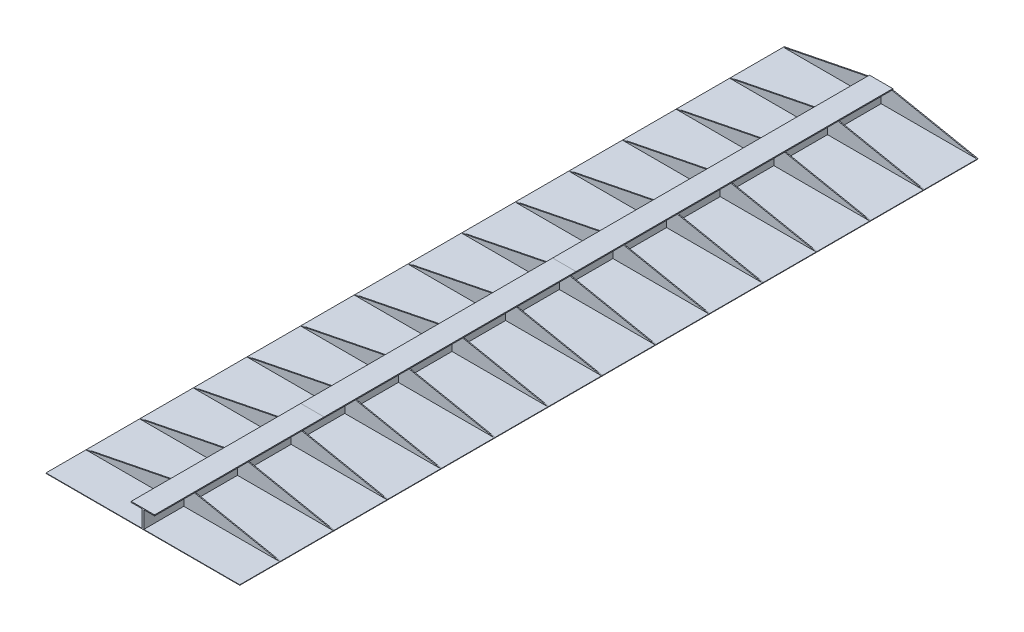
from build123d import *

# Parameters (mm, degrees)
BOSS_EXTRUDE1_DEPTH   = 7620
SKETCH7_W             = 110.65
SKETCH7_H             = 175.5
CUT_EXTRUDE3_DEPTH    = 7692.622044309
BOSS_EXTRUDE3_DEPTH   = 9.525
LPATTERN2_COUNT       = 14
LPATTERN2_PITCH       = 553.68
MIRROR2_COPY_1_DEPTH  = 9.525
MIRROR2_COPY_2_DEPTH  = 9.525
MIRROR2_COPY_3_DEPTH  = 9.525
MIRROR2_COPY_4_DEPTH  = 9.525
MIRROR2_COPY_5_DEPTH  = 9.525
MIRROR2_COPY_6_DEPTH  = 9.525
MIRROR2_COPY_7_DEPTH  = 9.525
MIRROR2_COPY_8_DEPTH  = 9.525
MIRROR2_COPY_9_DEPTH  = 9.525
MIRROR2_COPY_10_DEPTH = 9.525
MIRROR2_COPY_11_DEPTH = 9.525
MIRROR2_COPY_12_DEPTH = 9.525
MIRROR2_COPY_13_DEPTH = 9.525


with BuildPart() as part:
    # Sketch1 → Boss-Extrude1 (new body)
    with BuildSketch(Plane.XY):
        Polygon((-90, 185.5), (151.3, 185.5), (151.3, 0), (1030.65, 0), (1030.65, -5), (-969.35, -5), (-969.35, 0), (-90, 0), align=None)
    extrude(amount=-BOSS_EXTRUDE1_DEPTH)

    # Sketch7 → Cut-Extrude3 (cut, through all)
    with BuildSketch(Plane(origin=(0, 0, -7620), x_dir=(-1, 0, 0), z_dir=(0, 0, -1))):
        with Locations((-95.975, 87.75)):
            Rectangle(SKETCH7_W, SKETCH7_H)
        with Locations((34.675, 87.75)):
            Rectangle(SKETCH7_W, SKETCH7_H)
    extrude(amount=-CUT_EXTRUDE3_DEPTH, mode=Mode.SUBTRACT)

    # Sketch8 → Boss-Extrude3 (add)
    with BuildSketch(Plane(origin=(0, 0, -7620), x_dir=(-1, 0, 0), z_dir=(0, 0, -1))):
        Polygon((-40.65, 0), (-40.65, 175.5), (-151.3, 175.5), (-1030.65, 0), align=None)
    boss_extrude3 = extrude(amount=-BOSS_EXTRUDE3_DEPTH)

    # LPattern2: Boss-Extrude3 ×14
    with Locations(*[(0, 0, i * LPATTERN2_PITCH) for i in range(1, LPATTERN2_COUNT)]):
        add(boss_extrude3)

    # Mirror2: Boss-Extrude3 across plane
    add(boss_extrude3.mirror(Plane(origin=(30.65, 0, 0), x_dir=(0, 0, 1), z_dir=(1, 0, 0))))

    # Mirror2 copy 1 sketch → Mirror2 copy 1 (add)
    with BuildSketch(Plane(origin=(61.3, 0, -7066.32), x_dir=(1, 0, 0), z_dir=(0, 0, -1))):
        Polygon((-40.65, 0), (-40.65, -175.5), (-151.3, -175.5), (-1030.65, 0), align=None)
    extrude(amount=-MIRROR2_COPY_1_DEPTH)

    # Mirror2 copy 2 sketch → Mirror2 copy 2 (add)
    with BuildSketch(Plane(origin=(61.3, 0, -6512.64), x_dir=(1, 0, 0), z_dir=(0, 0, -1))):
        Polygon((-40.65, 0), (-40.65, -175.5), (-151.3, -175.5), (-1030.65, 0), align=None)
    extrude(amount=-MIRROR2_COPY_2_DEPTH)

    # Mirror2 copy 3 sketch → Mirror2 copy 3 (add)
    with BuildSketch(Plane(origin=(61.3, 0, -5958.96), x_dir=(1, 0, 0), z_dir=(0, 0, -1))):
        Polygon((-40.65, 0), (-40.65, -175.5), (-151.3, -175.5), (-1030.65, 0), align=None)
    extrude(amount=-MIRROR2_COPY_3_DEPTH)

    # Mirror2 copy 4 sketch → Mirror2 copy 4 (add)
    with BuildSketch(Plane(origin=(61.3, 0, -5405.28), x_dir=(1, 0, 0), z_dir=(0, 0, -1))):
        Polygon((-40.65, 0), (-40.65, -175.5), (-151.3, -175.5), (-1030.65, 0), align=None)
    extrude(amount=-MIRROR2_COPY_4_DEPTH)

    # Mirror2 copy 5 sketch → Mirror2 copy 5 (add)
    with BuildSketch(Plane(origin=(61.3, 0, -4851.6), x_dir=(1, 0, 0), z_dir=(0, 0, -1))):
        Polygon((-40.65, 0), (-40.65, -175.5), (-151.3, -175.5), (-1030.65, 0), align=None)
    extrude(amount=-MIRROR2_COPY_5_DEPTH)

    # Mirror2 copy 6 sketch → Mirror2 copy 6 (add)
    with BuildSketch(Plane(origin=(61.3, 0, -4297.92), x_dir=(1, 0, 0), z_dir=(0, 0, -1))):
        Polygon((-40.65, 0), (-40.65, -175.5), (-151.3, -175.5), (-1030.65, 0), align=None)
    extrude(amount=-MIRROR2_COPY_6_DEPTH)

    # Mirror2 copy 7 sketch → Mirror2 copy 7 (add)
    with BuildSketch(Plane(origin=(61.3, 0, -3744.24), x_dir=(1, 0, 0), z_dir=(0, 0, -1))):
        Polygon((-40.65, 0), (-40.65, -175.5), (-151.3, -175.5), (-1030.65, 0), align=None)
    extrude(amount=-MIRROR2_COPY_7_DEPTH)

    # Mirror2 copy 8 sketch → Mirror2 copy 8 (add)
    with BuildSketch(Plane(origin=(61.3, 0, -3190.56), x_dir=(1, 0, 0), z_dir=(0, 0, -1))):
        Polygon((-40.65, 0), (-40.65, -175.5), (-151.3, -175.5), (-1030.65, 0), align=None)
    extrude(amount=-MIRROR2_COPY_8_DEPTH)

    # Mirror2 copy 9 sketch → Mirror2 copy 9 (add)
    with BuildSketch(Plane(origin=(61.3, 0, -2636.88), x_dir=(1, 0, 0), z_dir=(0, 0, -1))):
        Polygon((-40.65, 0), (-40.65, -175.5), (-151.3, -175.5), (-1030.65, 0), align=None)
    extrude(amount=-MIRROR2_COPY_9_DEPTH)

    # Mirror2 copy 10 sketch → Mirror2 copy 10 (add)
    with BuildSketch(Plane(origin=(61.3, 0, -2083.2), x_dir=(1, 0, 0), z_dir=(0, 0, -1))):
        Polygon((-40.65, 0), (-40.65, -175.5), (-151.3, -175.5), (-1030.65, 0), align=None)
    extrude(amount=-MIRROR2_COPY_10_DEPTH)

    # Mirror2 copy 11 sketch → Mirror2 copy 11 (add)
    with BuildSketch(Plane(origin=(61.3, 0, -1529.52), x_dir=(1, 0, 0), z_dir=(0, 0, -1))):
        Polygon((-40.65, 0), (-40.65, -175.5), (-151.3, -175.5), (-1030.65, 0), align=None)
    extrude(amount=-MIRROR2_COPY_11_DEPTH)

    # Mirror2 copy 12 sketch → Mirror2 copy 12 (add)
    with BuildSketch(Plane(origin=(61.3, 0, -975.84), x_dir=(1, 0, 0), z_dir=(0, 0, -1))):
        Polygon((-40.65, 0), (-40.65, -175.5), (-151.3, -175.5), (-1030.65, 0), align=None)
    extrude(amount=-MIRROR2_COPY_12_DEPTH)

    # Mirror2 copy 13 sketch → Mirror2 copy 13 (add)
    with BuildSketch(Plane(origin=(61.3, 0, -422.16), x_dir=(1, 0, 0), z_dir=(0, 0, -1))):
        Polygon((-40.65, 0), (-40.65, -175.5), (-151.3, -175.5), (-1030.65, 0), align=None)
    extrude(amount=-MIRROR2_COPY_13_DEPTH)


solid = part.part
